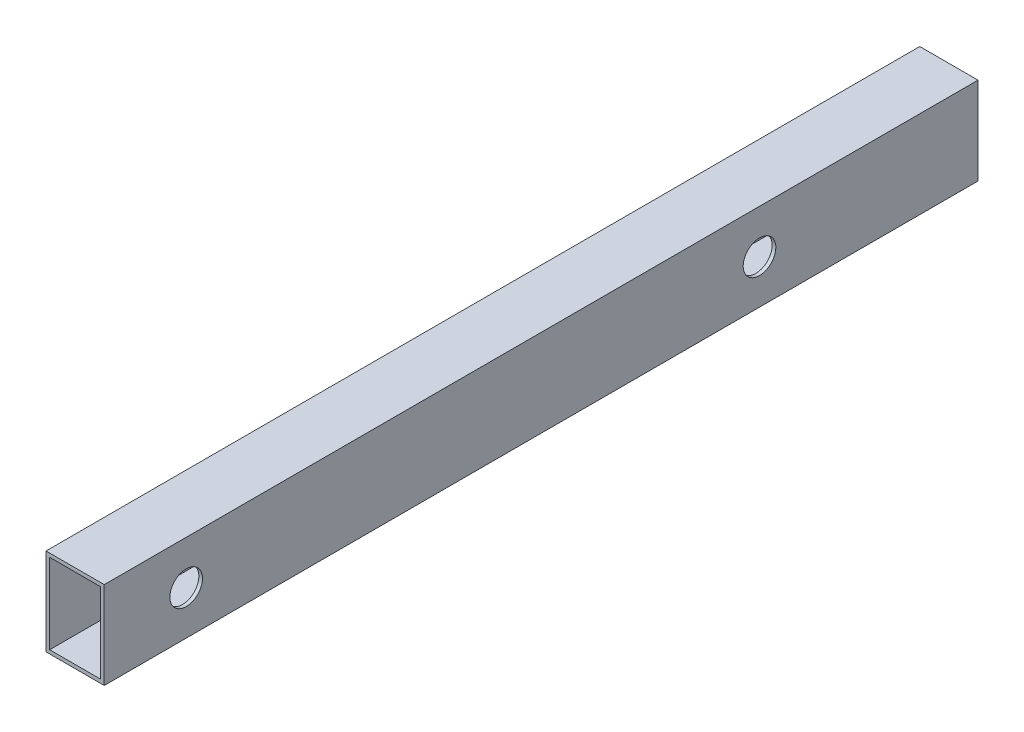
from build123d import *

# Parameters (mm, degrees)
SKETCH1_W           = 50.8
SKETCH1_H           = 76.2
SKETCH1_W_2         = 44.45
SKETCH1_H_2         = 69.85
BOSS_EXTRUDE1_DEPTH = 762
CUT_EXTRUDE1_REACH  = 766.641
SKETCH4_R           = 14.224


with BuildPart() as part:
    # Sketch1 → Boss-Extrude1 (new body)
    with BuildSketch(Plane.XY):
        Rectangle(SKETCH1_W, SKETCH1_H)
        Rectangle(SKETCH1_W_2, SKETCH1_H_2, mode=Mode.SUBTRACT)
    extrude(amount=BOSS_EXTRUDE1_DEPTH)

    # Cut-Extrude1: up to this face of the body (flat: up to its plane)
    cut_extrude1_end = Plane(part.part.faces().sort_by_distance((-25.4, 0, 381))[0])
    # Sketch4 → Cut-Extrude1 (cut, up to the picked face)
    with BuildSketch(Plane(origin=(25.4, 0, 0), x_dir=(0, 0, -1), z_dir=(1, 0, 0)), mode=Mode.PRIVATE) as cut_extrude1_sk1:
        with Locations(Location((-690.548048411, 0, 0), (0, 0, 90))):
            Circle(SKETCH4_R)
    cut_extrude1_tool1 = split(extrude(cut_extrude1_sk1.sketch, amount=-CUT_EXTRUDE1_REACH, mode=Mode.PRIVATE), bisect_by=cut_extrude1_end, keep=Keep.BOTH, mode=Mode.PRIVATE)
    # Sketch4 → Cut-Extrude1 (cut, up to the picked face)
    with BuildSketch(Plane(origin=(25.4, 0, 0), x_dir=(0, 0, -1), z_dir=(1, 0, 0)), mode=Mode.PRIVATE) as cut_extrude1_sk2:
        with Locations(Location((-190.549048411, 0, 0), (0, 0, 90))):
            Circle(SKETCH4_R)
    cut_extrude1_tool2 = split(extrude(cut_extrude1_sk2.sketch, amount=-CUT_EXTRUDE1_REACH, mode=Mode.PRIVATE), bisect_by=cut_extrude1_end, keep=Keep.BOTH, mode=Mode.PRIVATE)
    add(cut_extrude1_tool1.solids().sort_by(Axis((25.4, 0, 690.548048), (-1, 0, 0)))[0], mode=Mode.SUBTRACT)
    add(cut_extrude1_tool2.solids().sort_by(Axis((25.4, 0, 190.549048), (-1, 0, 0)))[0], mode=Mode.SUBTRACT)


solid = part.part
